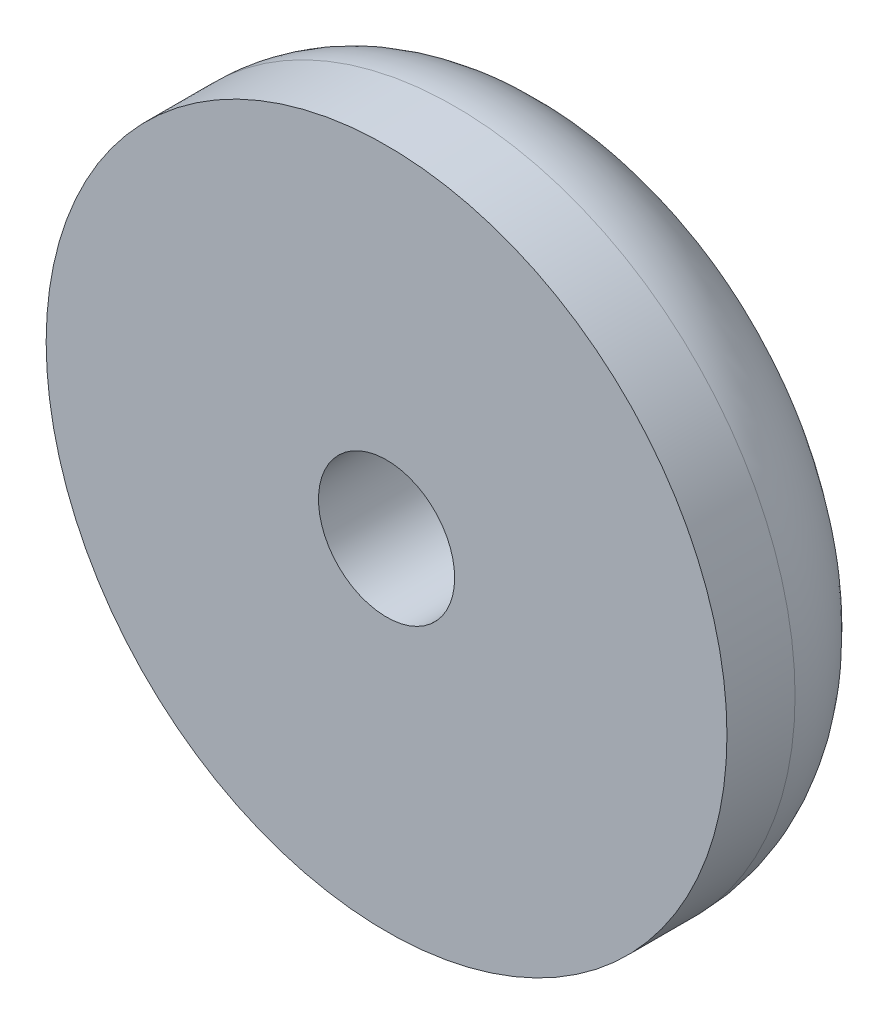
from build123d import *

# Parameters (mm, degrees)
SKETCH1_R           = 7.5
SKETCH1_R_2         = 1.5
BOSS_EXTRUDE1_DEPTH = 4
FILLET1_R           = 2.5


with BuildPart() as part:
    # Sketch1 → Boss-Extrude1 (new body)
    with BuildSketch(Plane.XY):
        Circle(SKETCH1_R)
        Circle(SKETCH1_R_2, mode=Mode.SUBTRACT)
    extrude(amount=BOSS_EXTRUDE1_DEPTH)

    # Fillet1
    fillet1_edges = [part.edges().sort_by_distance(p)[0] for p in [
        (-7.5, 0, 0),
    ]]
    fillet(fillet1_edges, radius=FILLET1_R)


solid = part.part
